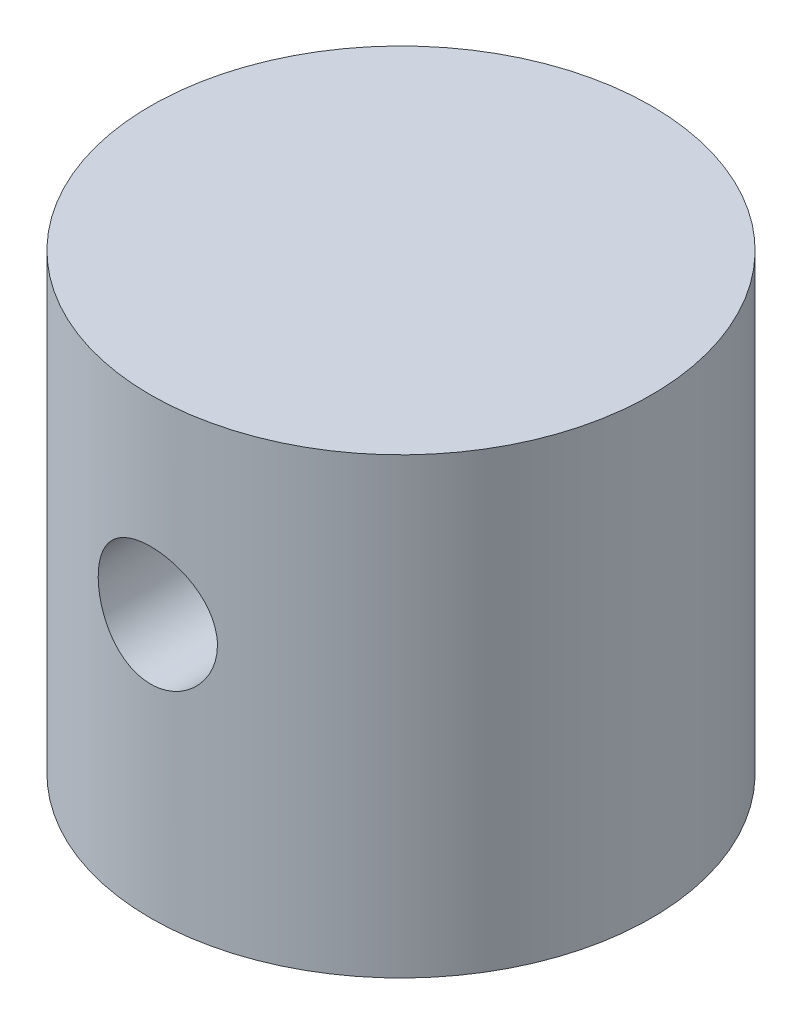
from build123d import *

# Parameters (mm, degrees)
SKETCH1_R               = 10.5
BOSS_EXTRUDE1_DEPTH     = 19
SKETCH2_R               = 10
CUT_EXTRUDE1_DEPTH      = 6
CUT_EXTRUDE2_DEPTH      = 11
CUT_EXTRUDE3_DEPTH      = 25.114311104
CUT_EXTRUDE3_DEPTH_BACK = 25.114311104
SKETCH4_R               = 2.5


with BuildPart() as part:
    # Sketch1 → Boss-Extrude1 (new body)
    with BuildSketch(Plane(origin=(0, 0, 0), x_dir=(1, 0, 0), z_dir=(0, 1, 0))):
        with Locations(Location((0, 0, 0), (0, 0, 270))):
            Circle(SKETCH1_R)
    extrude(amount=BOSS_EXTRUDE1_DEPTH)

    # Sketch2 → Cut-Extrude1 (cut)
    with BuildSketch(Plane.XZ):
        with Locations(Location((0, 0, 0), (0, 0, 270))):
            Circle(SKETCH2_R)
    extrude(amount=-CUT_EXTRUDE1_DEPTH, mode=Mode.SUBTRACT)

    # Sketch3 → Cut-Extrude2 (cut)
    with BuildSketch(Plane.XZ.offset(-6)):
        with BuildLine():
            Line((3, -6), (-3, -6))
            ThreePointArc((-3, -6), (-9, 0), (-3, 6))
            Line((-3, 6), (3, 6))
            ThreePointArc((3, 6), (9, 0), (3, -6))
        make_face()
    extrude(amount=-CUT_EXTRUDE2_DEPTH, mode=Mode.SUBTRACT)

    # Sketch4 → Cut-Extrude3 (cut, two sides: drawn at the far end of the back side and taken through both)
    with BuildSketch(Plane.XY.offset(-CUT_EXTRUDE3_DEPTH_BACK)):
        with Locations((0, 11)):
            Circle(SKETCH4_R)
    extrude(amount=CUT_EXTRUDE3_DEPTH + CUT_EXTRUDE3_DEPTH_BACK, mode=Mode.SUBTRACT)


solid = part.part
